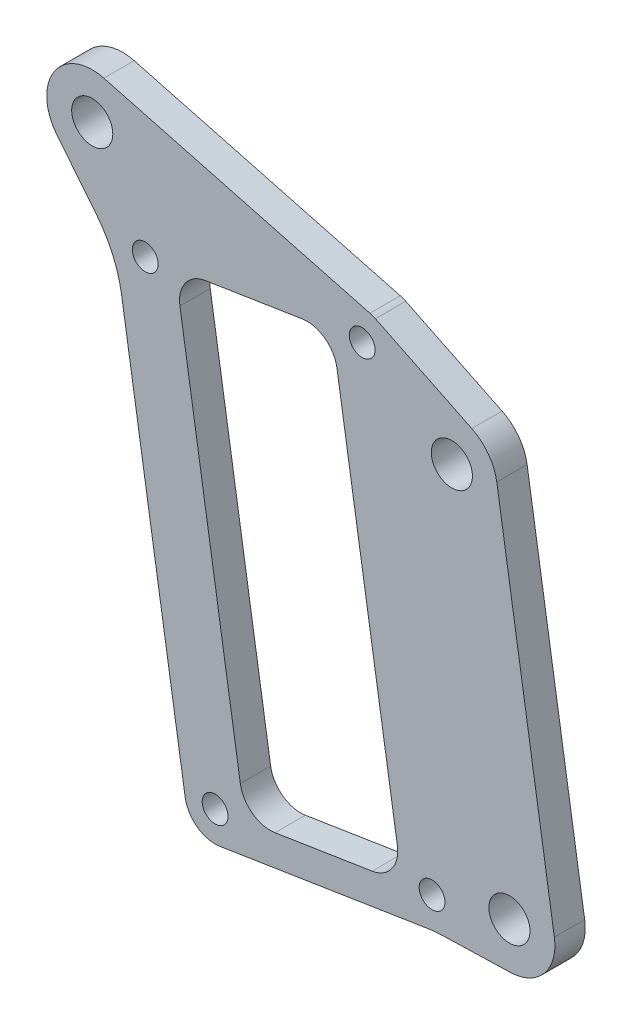
from build123d import *

# Parameters (mm, degrees)
BOSS_EXTRUDE1_DEPTH   = 3.175
FILLET1_R             = 3.175
FILLET2_R             = 12.7
F_2_CLEARANCE_HOLE1_D = 2.7051
F_6_CLEARANCE_HOLE1_D = 4.3053


with BuildPart() as part:
    # Sketch1 → Boss-Extrude1 (new body)
    with BuildSketch(Plane.XY):
        with BuildLine():
            Line((13.363407355, -58.995822037), (35.883167135, -55.446288697))
            Line((35.883167135, -55.446288697), (43.833071408, -55.214709803))
            ThreePointArc((43.833071408, -55.214709803), (47.359348086, -53.495537965), (48.398820761, -49.712724781))
            Line((48.398820761, -49.712724781), (42.367918864, -11.450100102))
            ThreePointArc((42.367918864, -11.450100102), (41.492080159, -9.359050224), (39.748688678, -7.90985418))
            Line((39.748688678, -7.90985418), (29.660979166, -2.997190284))
            ThreePointArc((29.660979166, -2.997190284), (29.377888176, -2.875939169), (29.084381769, -2.78268505))
            Line((29.084381769, -2.78268505), (1.220294786, 4.603508106))
            ThreePointArc((1.220294786, 4.603508106), (-3.993511378, 2.594855125), (-3.710688281, -2.98533059))
            Line((-3.710688281, -2.98533059), (2.546868459, -10.763310872))
            Line((2.546868459, -10.763310872), (9.732790422, -56.353877547))
            ThreePointArc((9.732790422, -56.353877547), (11.000934269, -58.426775179), (13.363407355, -58.995822037))
        make_face()
        Polygon((25.134571201, -6.346026675), (32.452304237, -52.772859253), (16.005351845, -55.365205105), (8.687618809, -8.938372527), align=None, mode=Mode.SUBTRACT)
    extrude(amount=BOSS_EXTRUDE1_DEPTH)

    # Fillet1
    fillet1_edges = [part.edges().sort_by_distance(p)[0] for p in [
        (32.452304237, -52.772859253, 1.5875),
        (25.134571201, -6.346026675, 1.5875),
        (8.687618809, -8.938372527, 1.5875),
        (16.005351845, -55.365205105, 1.5875),
    ]]
    fillet(fillet1_edges, radius=FILLET1_R)

    # Fillet2
    fillet2_edges = [part.edges().sort_by_distance(p)[0] for p in [
        (2.546868459, -10.763310872, 1.5875),
        (35.883167135, -55.446288697, 1.5875),
    ]]
    fillet(fillet2_edges, radius=FILLET2_R)

    # #2 Clearance Hole1 (through all)
    with Locations(Plane.XY.offset(3.175)):
        with Locations((5.551338097, -9.432708748), (28.270851912, -5.851690454), (35.588584948, -52.278523032), (12.869071133, -55.859541326)):
            Hole(F_2_CLEARANCE_HOLE1_D / 2)

    # #6 Clearance Hole1 (through all)
    with Locations(Plane.XY.offset(3.175)):
        with Locations((0, 0), (37.663497797, -12.191604434), (43.694399694, -50.454229113)):
            Hole(F_6_CLEARANCE_HOLE1_D / 2)


solid = part.part
